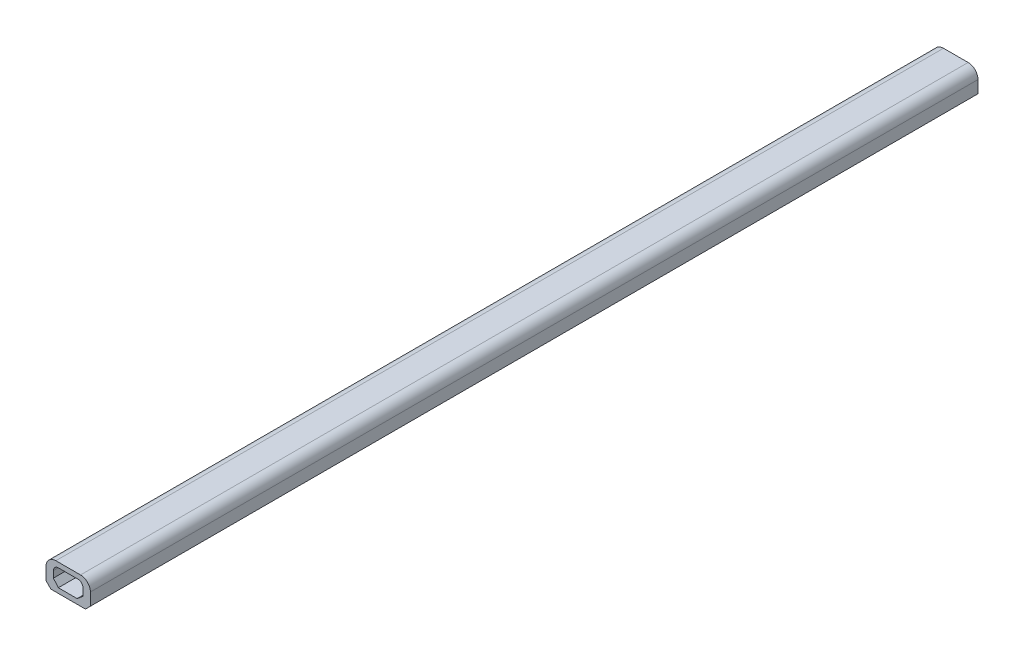
from build123d import *
from OCP.BRepFilletAPI import BRepFilletAPI_MakeChamfer

# Parameters (mm, degrees)
SKETCH1_W           = 9
SKETCH1_H           = 5.5
BOSS_EXTRUDE1_DEPTH = 180
FILLET1_R           = 2
CHAMFER1_SIZE       = 1
SKETCH2_W           = 6
SKETCH2_H           = 3.5
CUT_EXTRUDE2_DEPTH  = 181.30876296
FILLET2_R           = 1
CHAMFER2_SIZE       = 1
CHAMFER2_SIZE2      = 1.191753593


with BuildPart() as part:
    # Sketch1 → Boss-Extrude1 (new body)
    with BuildSketch(Plane.XY):
        with Locations((4.5, -2.75)):
            Rectangle(SKETCH1_W, SKETCH1_H)
    extrude(amount=BOSS_EXTRUDE1_DEPTH)

    # Fillet1
    fillet1_edges = [part.edges().sort_by_distance(p)[0] for p in [
        (0, 0, 90),
        (9, 0, 90),
    ]]
    fillet(fillet1_edges, radius=FILLET1_R)

    # Chamfer1
    chamfer1_edges = [part.edges().sort_by_distance(p)[0] for p in [
        (9, -5.5, 90),
        (0, -5.5, 90),
    ]]
    chamfer(chamfer1_edges, length=CHAMFER1_SIZE)

    # Sketch2 → Cut-Extrude2 (cut, through all)
    with BuildSketch(Plane(origin=(0, 0, 0), x_dir=(-1, 0, 0), z_dir=(0, 0, -1))):
        with Locations((-4.5, -2.75)):
            Rectangle(SKETCH2_W, SKETCH2_H)
    extrude(amount=-CUT_EXTRUDE2_DEPTH, mode=Mode.SUBTRACT)

    # Fillet2
    fillet2_edges = [part.edges().sort_by_distance(p)[0] for p in [
        (7.5, -1, 90),
        (1.5, -1, 90),
    ]]
    fillet(fillet2_edges, radius=FILLET2_R)

    # Chamfer2: one chamfer whose edges measure the first distance from different faces: ONE call of the kernel's chamfer builder (chamfer() names one face for all edges)
    chamfer2_edges_1 = [part.edges().sort_by_distance(p)[0] for p in [
        (1.5, -4.5, 90),
    ]]
    chamfer2_side_1 = [part.faces().sort_by_distance(p)[0] for p in [
        (4.5, -4.5, 90),
    ]]
    chamfer2_edges_2 = [part.edges().sort_by_distance(p)[0] for p in [
        (7.5, -4.5, 90),
    ]]
    chamfer2_side_2 = [part.faces().sort_by_distance(p)[0] for p in [
        (7.5, -3.25, 90),
    ]]
    chamfer2 = BRepFilletAPI_MakeChamfer(part.part.solid().wrapped)
    for e in chamfer2_edges_1:
        chamfer2.Add(CHAMFER2_SIZE, CHAMFER2_SIZE2, e.wrapped, chamfer2_side_1[0].wrapped)  # the first distance lies on this face
    for e in chamfer2_edges_2:
        chamfer2.Add(CHAMFER2_SIZE, CHAMFER2_SIZE2, e.wrapped, chamfer2_side_2[0].wrapped)  # the first distance lies on this face
    add(Compound.cast(chamfer2.Shape()), mode=Mode.REPLACE)


solid = part.part
